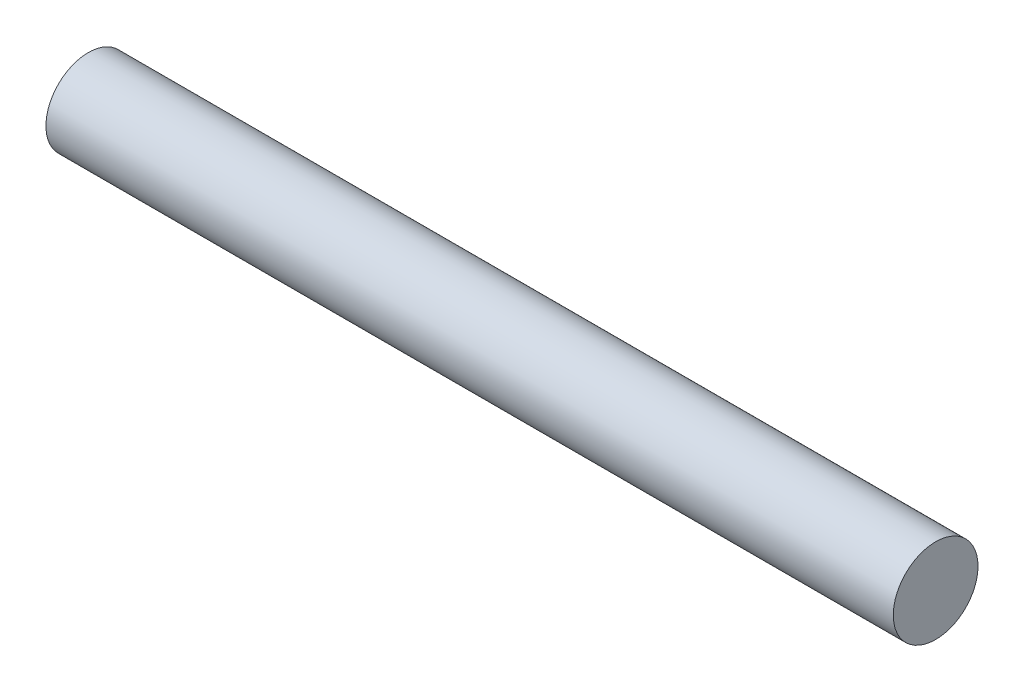
from build123d import *

# Parameters (mm, degrees)
SKETCH2_R           = 2.5
BOSS_EXTRUDE1_DEPTH = 50


with BuildPart() as part:
    # Sketch2 → Boss-Extrude1 (new body)
    with BuildSketch(Plane(origin=(0, 0, 0), x_dir=(0, 0, -1), z_dir=(1, 0, 0))):
        Circle(SKETCH2_R)
    extrude(amount=BOSS_EXTRUDE1_DEPTH)


solid = part.part
